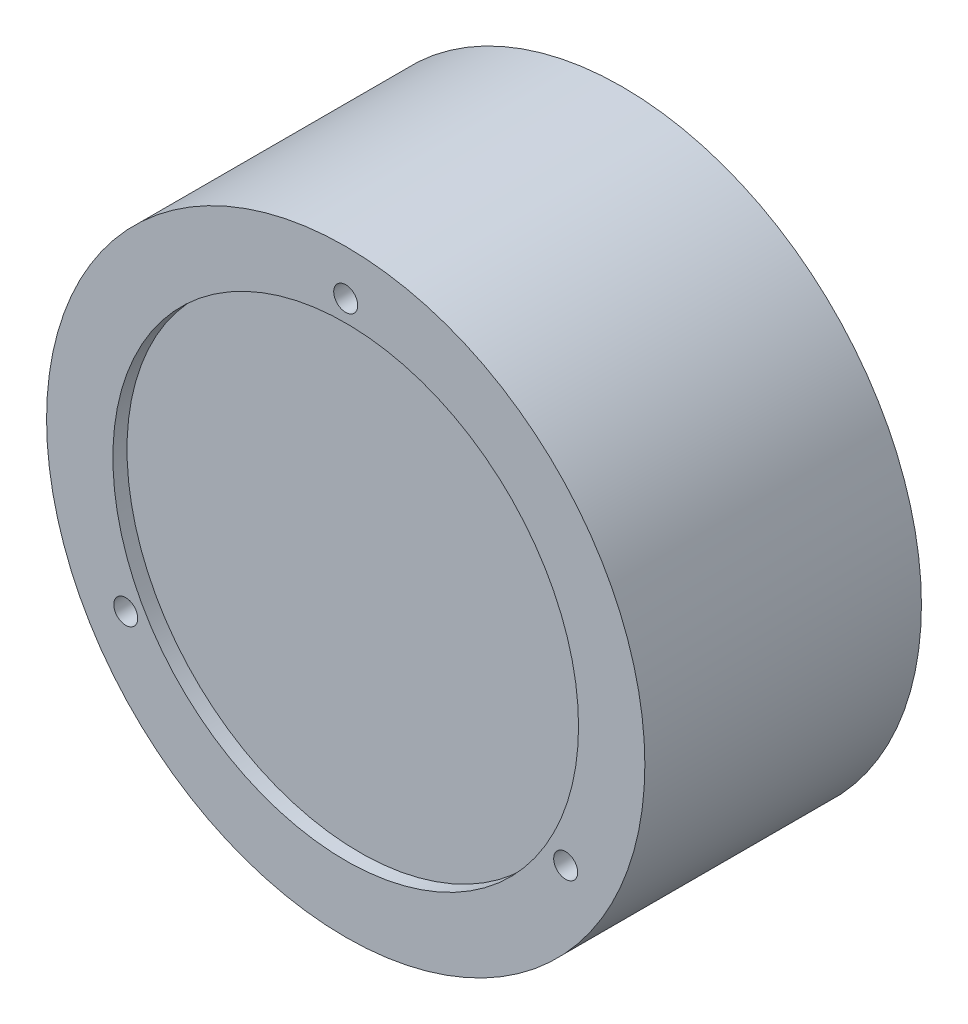
from build123d import *

# Parameters (mm, degrees)
SKETCH_1_R                   = 106
EXTRUDE_1_DEPTH              = 98
SKETCH_2_R                   = 82.5
CUT_EXTRUDE_1_DEPTH          = 5
PATTERN_CIRCULAR_1_COUNT     = 3
HOLE_WIZARD_M10_2_AT_2_COUNT = 2
HOLE_WIZARD_M10_2_AT_2_PITCH = 25
PATTERN_CIRCULAR_2_COUNT     = 3


with BuildPart() as part:
    # 草图1 → 凸台-拉伸1 (new body)
    with BuildSketch(Plane.XY):
        Circle(SKETCH_1_R)
    extrude(amount=EXTRUDE_1_DEPTH)

    # 草图2 → 切除-拉伸1 (cut)
    with BuildSketch(Plane.XY.offset(98)):
        Circle(SKETCH_2_R)
    extrude(amount=-CUT_EXTRUDE_1_DEPTH, mode=Mode.SUBTRACT)

    # 草图3 → M10 螺纹孔1 (revolve, cut)
    with BuildSketch(Plane(origin=(0, 90, 98), x_dir=(0, -1, 0), z_dir=(1, 0, 0))):
        Polygon((0, 0), (0, 32.553657631), (4.25, 30), (4.25, 0), align=None)
    hole_wizard_m10_1 = revolve(axis=Axis((0, 90, 104.35), (0, 0, -1)), mode=Mode.SUBTRACT)

    # 阵列(圆周)1: M10 螺纹孔1 ×3 about axis
    pattern_circular_1_axis = Axis((0, 0, 0), (0, 0, 1))
    for i in range(1, PATTERN_CIRCULAR_1_COUNT):
        add(hole_wizard_m10_1.rotate(pattern_circular_1_axis, i * 360 / PATTERN_CIRCULAR_1_COUNT), mode=Mode.SUBTRACT)

    # 草图5 → M10 螺纹孔2 (revolve, cut)
    with BuildSketch(Plane(origin=(0, 100, 0), x_dir=(0, 1, 0), z_dir=(1, 0, 0))):
        Polygon((0, 0), (0, 27.053657631), (4.25, 24.5), (4.25, 0), align=None)
    hole_wizard_m10_2 = revolve(axis=Axis((0, 100, -6.35), (0, 0, 1)), mode=Mode.SUBTRACT)

    # M10 螺纹孔2 at 2: M10 螺纹孔2 ×2
    with Locations(*[(0, -i * HOLE_WIZARD_M10_2_AT_2_PITCH, 0) for i in range(1, HOLE_WIZARD_M10_2_AT_2_COUNT)]):
        add(hole_wizard_m10_2, mode=Mode.SUBTRACT)

    # 阵列(圆周)2: M10 螺纹孔2 ×3 about axis
    pattern_circular_2_axis = Axis((0, 0, 0), (0, 0, 1))
    for i in range(1, PATTERN_CIRCULAR_2_COUNT):
        add(hole_wizard_m10_2.rotate(pattern_circular_2_axis, i * 360 / PATTERN_CIRCULAR_2_COUNT), mode=Mode.SUBTRACT)

    # 阵列(圆周)2 copy 1 sketch → 阵列(圆周)2 copy 1 (revolve, cut)
    with BuildSketch(Plane(origin=(-64.951905284, -37.5, 0), x_dir=(-0.8660254037844387, -0.4999999999999998, 0), z_dir=(-0.4999999999999998, 0.8660254037844387, 0))):
        Polygon((0, 0), (0, 27.053657631), (4.25, 24.5), (4.25, 0), align=None)
    revolve(axis=Axis((-64.951905284, -37.5, -6.35), (0, 0, 1)), mode=Mode.SUBTRACT)

    # 阵列(圆周)2 copy 2 sketch → 阵列(圆周)2 copy 2 (revolve, cut)
    with BuildSketch(Plane(origin=(64.951905284, -37.5, 0), x_dir=(0.8660254037844384, -0.5000000000000004, 0), z_dir=(-0.5000000000000004, -0.8660254037844384, 0))):
        Polygon((0, 0), (0, 27.053657631), (4.25, 24.5), (4.25, 0), align=None)
    revolve(axis=Axis((64.951905284, -37.5, -6.35), (0, 0, 1)), mode=Mode.SUBTRACT)


solid = part.part
